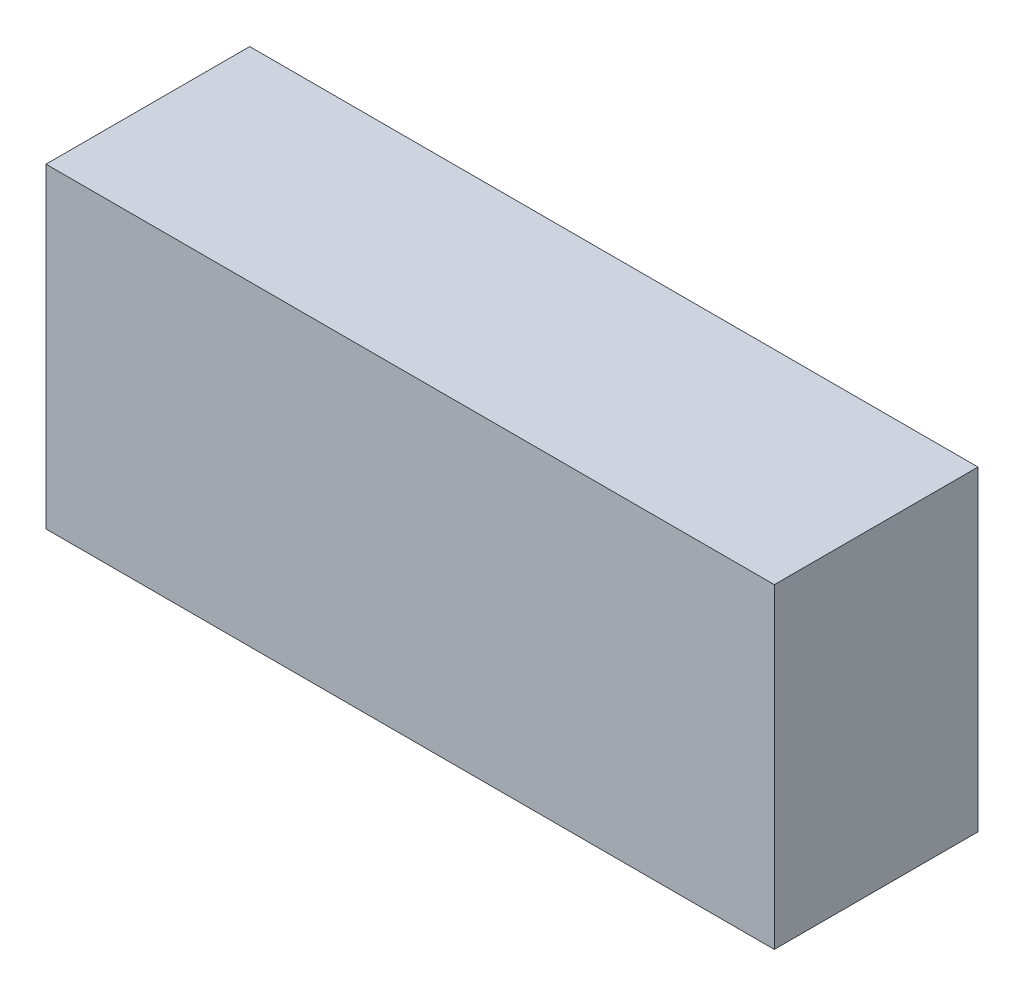
from build123d import *

# Parameters (mm, degrees)
SKETCH1_W           = 87.6
SKETCH1_H           = 38
BOSS_EXTRUDE1_DEPTH = 12.25


with BuildPart() as part:
    # Sketch1 → Boss-Extrude1 (new, symmetric)
    with BuildSketch(Plane.XY):
        Rectangle(SKETCH1_W, SKETCH1_H)
    extrude(amount=BOSS_EXTRUDE1_DEPTH, both=True)


solid = part.part
